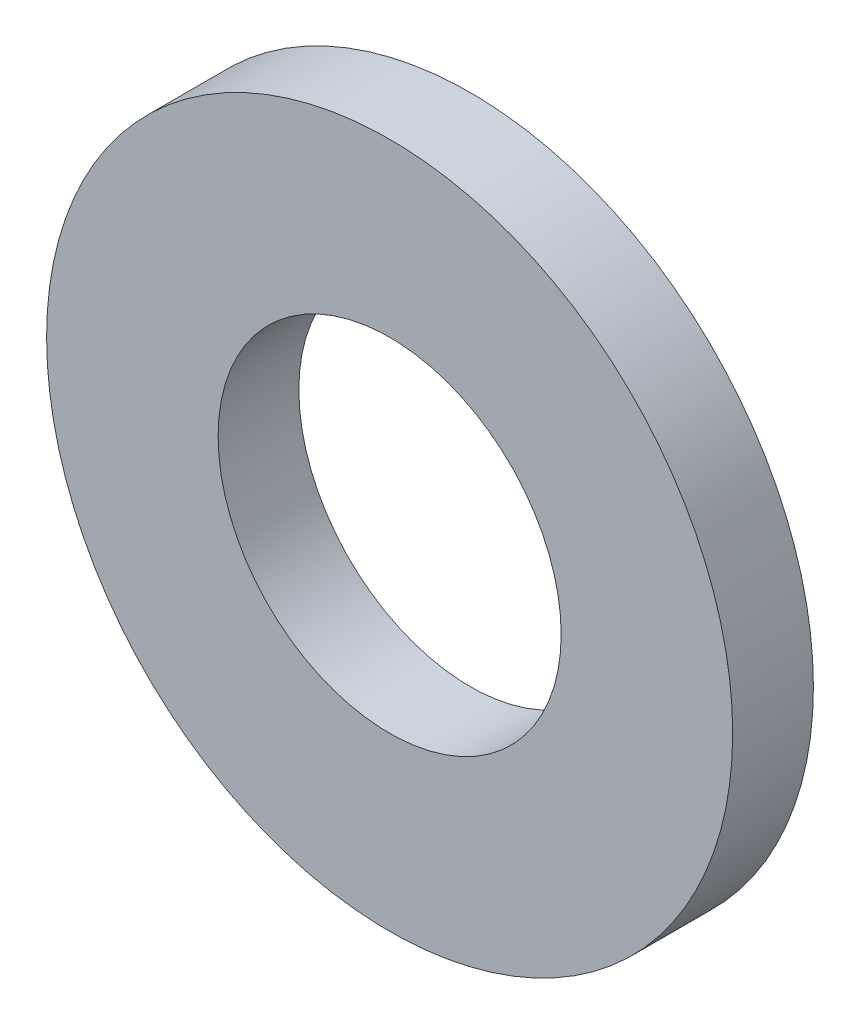
from build123d import *

# Parameters (mm, degrees)
SKETCH1_R           = 8.5
SKETCH1_R_2         = 4.25
BOSS_EXTRUDE1_DEPTH = 2


with BuildPart() as part:
    # Sketch1 → Boss-Extrude1 (new body)
    with BuildSketch(Plane.XY):
        Circle(SKETCH1_R)
        Circle(SKETCH1_R_2, mode=Mode.SUBTRACT)
    extrude(amount=BOSS_EXTRUDE1_DEPTH)


solid = part.part
